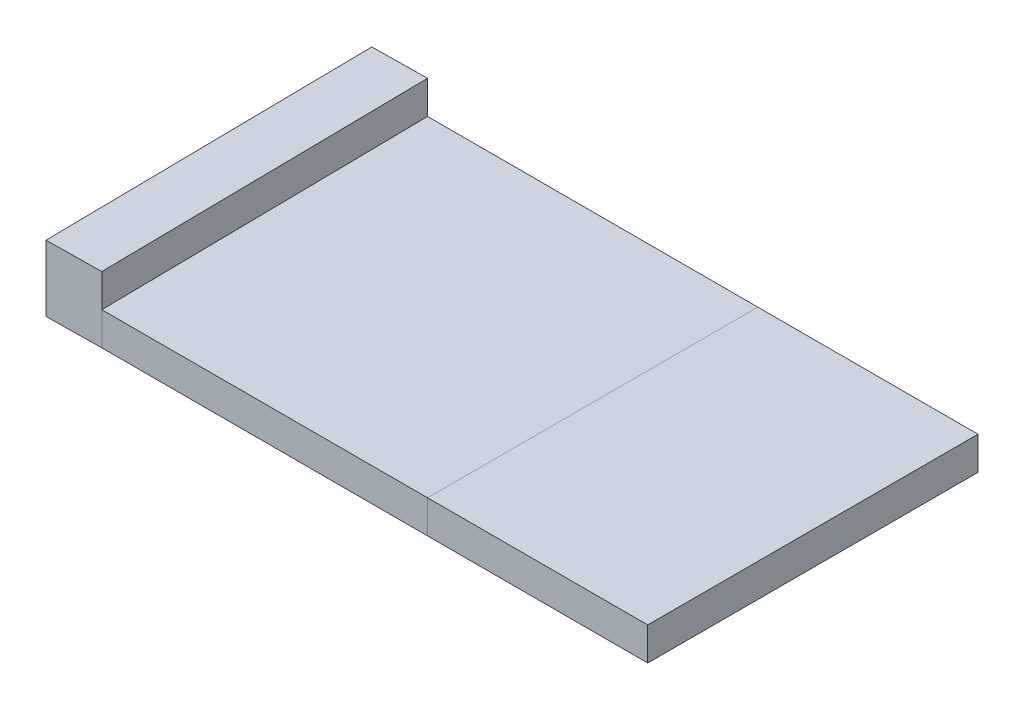
from build123d import *

# Parameters (mm, degrees)
EXTRUDE_1_DEPTH = 30
SKETCH_2_W      = 300
SKETCH_2_H      = 30
EXTRUDE_2_DEPTH = 200
SKETCH_3_W      = 300.027292571
SKETCH_3_H      = 60
EXTRUDE_3_DEPTH = 50


with BuildPart() as part:
    # 草图1 → 凸台-拉伸1 (new body)
    with BuildSketch(Plane(origin=(0, 0, 0), x_dir=(1, 0, 0), z_dir=(0, 1, 0))):
        Polygon((0, 0), (295.95323741, 0), (295.95323741, 300), (-4.04676259, 300), align=None)
    extrude(amount=EXTRUDE_1_DEPTH)

    # 草图3 → 凸台-拉伸3 (add)
    with BuildSketch(Plane(origin=(0, 0, 0), x_dir=(0.013487981560780847, 0, 0.9999090330392142), z_dir=(-0.9999090330392142, 0, 0.013487981560780847))):
        with Locations((-150.013646286, 30)):
            Rectangle(SKETCH_3_W, SKETCH_3_H)
    extrude(amount=EXTRUDE_3_DEPTH)


with BuildPart() as body_2:
    # 草图2 → 凸台-拉伸2 (new body)
    with BuildSketch(Plane(origin=(295.95323741, 0, 0), x_dir=(0, 0, -1), z_dir=(1, 0, 0))):
        with Locations((150, 15)):
            Rectangle(SKETCH_2_W, SKETCH_2_H)
    extrude(amount=EXTRUDE_2_DEPTH)


solid = Compound([part.part, body_2.part])
